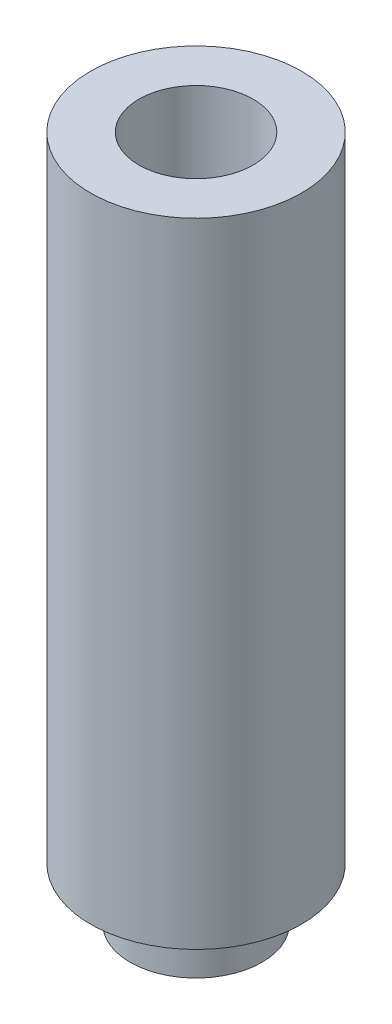
from build123d import *

# Parameters (mm, degrees)
SKETCH1_R           = 2.54
BOSS_EXTRUDE1_DEPTH = 15.24
SKETCH2_R           = 1.375
CUT_EXTRUDE1_DEPTH  = 12.7
SKETCH4_R           = 1.5875
SKETCH4_R_2         = 1.3335
EXTRUDE_THIN1_DEPTH = 1.27


with BuildPart() as part:
    # Sketch1 → Boss-Extrude1 (new body)
    with BuildSketch(Plane(origin=(0, 0, 0), x_dir=(1, 0, 0), z_dir=(0, 1, 0))):
        with Locations(Location((0, 0, 0), (0, 0, 90))):
            Circle(SKETCH1_R)
    extrude(amount=BOSS_EXTRUDE1_DEPTH)

    # Sketch2 → Cut-Extrude1 (cut)
    with BuildSketch(Plane(origin=(0, 15.24, 0), x_dir=(1, 0, 0), z_dir=(0, 1, 0))):
        with Locations(Location((0, 0, 0), (0, 0, 270))):
            Circle(SKETCH2_R)
    extrude(amount=-CUT_EXTRUDE1_DEPTH, mode=Mode.SUBTRACT)

    # Sketch4 → Extrude-Thin1 (add)
    with BuildSketch(Plane.XZ):
        Circle(SKETCH4_R)
        Circle(SKETCH4_R_2, mode=Mode.SUBTRACT)
    extrude(amount=EXTRUDE_THIN1_DEPTH)


solid = part.part
